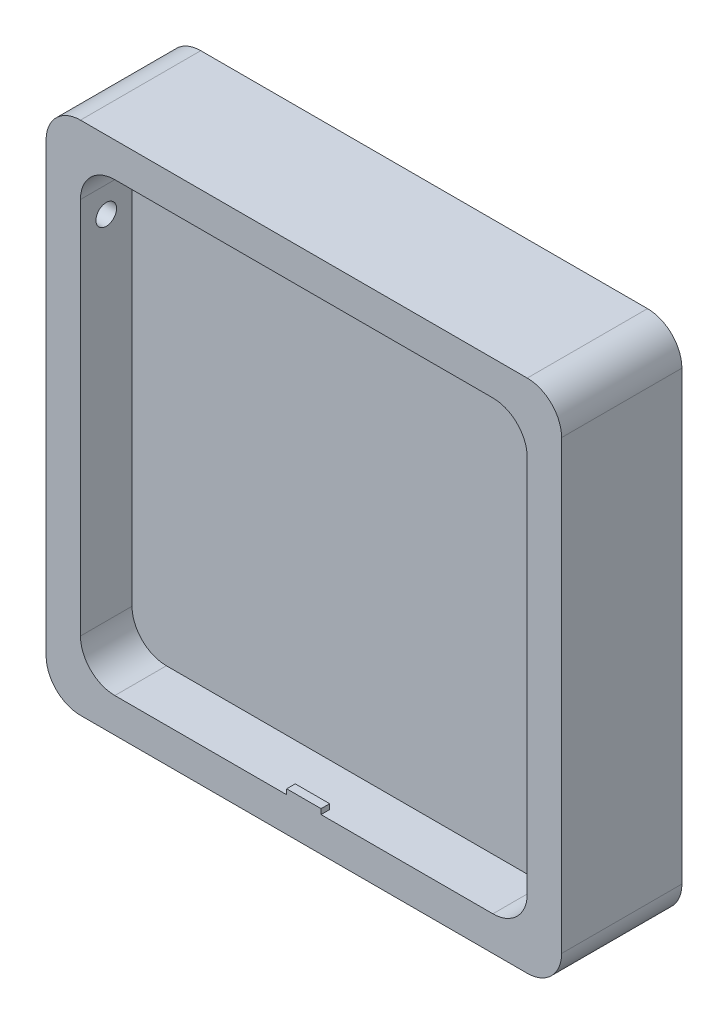
from build123d import *

# Parameters (mm, degrees)
EXTRUDE_1_DEPTH     = 5
EXTRUDE_START       = -2
EXTRUDE_3_DEPTH     = 2
EXTRUDE_4_DEPTH     = 1
SKETCH_9_R          = 13.798918301
SKETCH_9_R_2        = 9.326125992
CUT_EXTRUDE_2_DEPTH = 0.6
SKETCH_9_3_R        = 13.798918301
SKETCH_9_3_R_2      = 9.326125992
EXTRUDE_7_DEPTH     = 0.6
EXTRUDE_7_2_DEPTH   = 0.6
SKETCH_9_4_R        = 1.04307169
SKETCH_9_4_R_2      = 0.987090177
CUT_EXTRUDE_3_DEPTH = 23.338307904
EXTRUDE_8_DEPTH     = 0.6
EXTRUDE_8_2_DEPTH   = 0.6
EXTRUDE_8_3_DEPTH   = 0.6
EXTRUDE_8_4_DEPTH   = 0.6
EXTRUDE_8_5_DEPTH   = 0.6
EXTRUDE_8_6_DEPTH   = 0.6
EXTRUDE_8_7_DEPTH   = 0.6
EXTRUDE_8_8_DEPTH   = 0.6
SKETCH_9_5_R        = 1.04307169
EXTRUDE_8_9_DEPTH   = 0.6
SKETCH_9_5_R_2      = 0.987090177
EXTRUDE_8_10_DEPTH  = 0.6
SKETCH_10_R         = 0.987090177
SKETCH_10_R_2       = 1.04307169
EXTRUDE_9_DEPTH     = 0.6
EXTRUDE_11_DEPTH    = 0.4
SKETCH_12_R         = 0.6
CUT_EXTRUDE_4_DEPTH = 1.2
SKETCH_13_W         = 2
SKETCH_13_H         = 0.5
EXTRUDE_12_DEPTH    = 0.3


with BuildPart() as part:
    # 草图1 → 凸台-拉伸1 (new body)
    with BuildSketch(Plane.XY):
        with BuildLine():
            Line((13, 15), (-13, 15))
            ThreePointArc((-13, 15), (-14.414213562, 14.414213562), (-15, 13))
            Line((-15, 13), (-15, -13))
            ThreePointArc((-15, -13), (-14.414213562, -14.414213562), (-13, -15))
            Line((-13, -15), (13, -15))
            ThreePointArc((13, -15), (14.414213562, -14.414213562), (15, -13))
            Line((15, -13), (15, 13))
            ThreePointArc((15, 13), (14.414213562, 14.414213562), (13, 15))
        make_face()
        with BuildLine():
            ThreePointArc((-13, 11), (-12.414213562, 12.414213562), (-11, 13))
            Line((-11, 13), (11, 13))
            ThreePointArc((11, 13), (12.414213562, 12.414213562), (13, 11))
            Line((13, 11), (13, -11))
            ThreePointArc((13, -11), (12.414213562, -12.414213562), (11, -13))
            Line((11, -13), (-11, -13))
            ThreePointArc((-11, -13), (-12.414213562, -12.414213562), (-13, -11))
            Line((-13, -11), (-13, 11))
        make_face(mode=Mode.SUBTRACT)
    extrude(amount=EXTRUDE_1_DEPTH)

    # 草图1<7> → 凸台-拉伸3 (add)
    with BuildSketch(Plane.XY.offset(EXTRUDE_START)):
        with BuildLine():
            Line((-13, 15), (13, 15))
            ThreePointArc((13, 15), (14.414213562, 14.414213562), (15, 13))
            Line((15, 13), (15, -13))
            ThreePointArc((15, -13), (14.414213562, -14.414213562), (13, -15))
            Line((13, -15), (-13, -15))
            ThreePointArc((-13, -15), (-14.414213562, -14.414213562), (-15, -13))
            Line((-15, -13), (-15, 13))
            ThreePointArc((-15, 13), (-14.414213562, 14.414213562), (-13, 15))
        make_face()
    extrude(amount=EXTRUDE_3_DEPTH)

    # 草图3 → 凸台-拉伸4 (add)
    with BuildSketch(Plane.XY):
        with BuildLine():
            Line((-13, 11), (-13, -11))
            ThreePointArc((-13, -11), (-12.414213562, -12.414213562), (-11, -13))
            Line((-11, -13), (11, -13))
            ThreePointArc((11, -13), (12.414213562, -12.414213562), (13, -11))
            Line((13, -11), (13, 11))
            ThreePointArc((13, 11), (12.414213562, 12.414213562), (11, 13))
            Line((11, 13), (-11, 13))
            ThreePointArc((-11, 13), (-12.414213562, 12.414213562), (-13, 11))
        make_face()
    extrude(amount=EXTRUDE_4_DEPTH)

    # 草图9 → 切除-拉伸2 (cut)
    # profile 1 of 2: a face of its own
    with BuildSketch(Plane(origin=(0, 0, -2), x_dir=(-1, 0, 0), z_dir=(0, 0, -1))):
        Circle(SKETCH_9_R)
        with BuildLine():
            Line((-9.888054162, 2.28406073), (-12.681467364, 2.86316996))
            ThreePointArc((-12.681467364, 2.86316996), (-12.026515846, 4.937638437), (-11.034829358, 6.873856106))
            Line((-11.034829358, 6.873856106), (-8.690845875, 5.240204816))
            ThreePointArc((-8.690845875, 5.240204816), (-9.406305259, 3.809457956), (-9.888054162, 2.28406073))
        make_face(mode=Mode.SUBTRACT)
        with BuildLine():
            Line((-12.836530991, 2.059327278), (-10.028072657, 1.558302708))
            ThreePointArc((-10.028072657, 1.558302708), (-10.148356629, -0.037500321), (-10.016282444, -1.632370833))
            Line((-10.016282444, -1.632370833), (-12.816847155, -2.178482435))
            ThreePointArc((-12.816847155, -2.178482435), (-13.000527311, -0.060385025), (-12.836530991, 2.059327278))
        make_face(mode=Mode.SUBTRACT)
        with BuildLine():
            ThreePointArc((-5.987514309, 8.193913652), (-7.237123745, 7.114393047), (-8.295115314, 5.846504124))
            Line((-8.295115314, 5.846504124), (-10.626479159, 7.489679393))
            ThreePointArc((-10.626479159, 7.489679393), (-9.235940193, 9.149577338), (-7.589178852, 10.555648776))
            Line((-7.589178852, 10.555648776), (-5.987514309, 8.193913652))
        make_face(mode=Mode.SUBTRACT)
        with BuildLine():
            ThreePointArc((-2.416213789, 9.856594719), (-3.928425922, 9.357244162), (-5.343900786, 8.62747199))
            Line((-5.343900786, 8.62747199), (-6.941344254, 10.992501839))
            ThreePointArc((-6.941344254, 10.992501839), (-5.025776621, 11.989951046), (-2.971514644, 12.656518378))
            Line((-2.971514644, 12.656518378), (-2.416213789, 9.856594719))
        make_face(mode=Mode.SUBTRACT)
        with BuildLine():
            ThreePointArc((1.596521353, 10.022059075), (-0.038344555, 10.148353474), (-1.672209416, 10.009708498))
            Line((-1.672209416, 10.009708498), (-2.142188245, 12.82296324))
            ThreePointArc((-2.142188245, 12.82296324), (-0.017076876, 13.000656334), (2.108493972, 12.828546679))
            Line((2.108493972, 12.828546679), (1.596521353, 10.022059075))
        make_face(mode=Mode.SUBTRACT)
        with BuildLine():
            ThreePointArc((5.343900786, 8.62747199), (3.885665248, 9.375081553), (2.326115048, 9.87824566))
            Line((2.326115048, 9.87824566), (2.928030111, 12.666648981))
            ThreePointArc((2.928030111, 12.666648981), (4.987769571, 12.005811569), (6.909423009, 11.012594173))
            Line((6.909423009, 11.012594173), (5.343900786, 8.62747199))
        make_face(mode=Mode.SUBTRACT)
        with BuildLine():
            ThreePointArc((8.260078071, 5.895901865), (7.188306235, 7.16371426), (5.924174204, 8.239824545))
            Line((5.924174204, 8.239824545), (7.589178852, 10.555648776))
            ThreePointArc((7.589178852, 10.555648776), (9.208598496, 9.177094882), (10.581594608, 7.552960498))
            Line((10.581594608, 7.552960498), (8.260078071, 5.895901865))
        make_face(mode=Mode.SUBTRACT)
        with BuildLine():
            ThreePointArc((9.871964238, 2.352630574), (9.386242023, 3.858627895), (8.672317136, 5.270812463))
            Line((8.672317136, 5.270812463), (11.04594037, 6.855987024))
            ThreePointArc((11.04594037, 6.855987024), (12.005151381, 4.989358381), (12.651522641, 2.992713082))
            Line((12.651522641, 2.992713082), (9.871964238, 2.352630574))
        make_face(mode=Mode.SUBTRACT)
        with BuildLine():
            Line((10.029029819, 1.552130611), (12.847714869, 1.988360978))
            ThreePointArc((12.847714869, 1.988360978), (13.000310842, -0.096305483), (12.816847155, -2.178482435))
            Line((12.816847155, -2.178482435), (10.016282444, -1.632370833))
            ThreePointArc((10.016282444, -1.632370833), (10.148344608, -0.040623235), (10.029029819, 1.552130611))
        make_face(mode=Mode.SUBTRACT)
        with BuildLine():
            ThreePointArc((8.634150681, -5.333103276), (9.350135065, -3.945316565), (9.844729186, -2.464113591))
            Line((9.844729186, -2.464113591), (12.651522641, -2.992713082))
            ThreePointArc((12.651522641, -2.992713082), (11.983419277, -5.04133109), (10.986110749, -6.951455051))
            Line((10.986110749, -6.951455051), (8.634150681, -5.333103276))
        make_face(mode=Mode.SUBTRACT)
        with BuildLine():
            ThreePointArc((5.924174204, -8.239824545), (7.131904343, -7.219867657), (8.166588622, -6.024730601))
            Line((8.166588622, -6.024730601), (10.491279463, -7.677917162))
            ThreePointArc((10.491279463, -7.677917162), (9.12353904, -9.261662491), (7.519422651, -10.605453301))
            Line((7.519422651, -10.605453301), (5.924174204, -8.239824545))
        make_face(mode=Mode.SUBTRACT)
        with BuildLine():
            ThreePointArc((2.326115048, -9.87824566), (3.837148299, -9.395043452), (5.25441592, -8.682261334))
            Line((5.25441592, -8.682261334), (6.781441979, -11.091861945))
            ThreePointArc((6.781441979, -11.091861945), (4.88394496, -12.048420575), (2.855967553, -12.683091345))
            Line((2.855967553, -12.683091345), (2.326115048, -9.87824566))
        make_face(mode=Mode.SUBTRACT)
        with BuildLine():
            ThreePointArc((-1.598389743, -10.021761261), (-0.029492738, -10.148383059), (1.540113724, -10.030882227))
            Line((1.540113724, -10.030882227), (2.033639821, -12.8406256))
            ThreePointArc((2.033639821, -12.8406256), (-0.038615823, -13.000610199), (-2.109884502, -12.828318055))
            Line((-2.109884502, -12.828318055), (-1.598389743, -10.021761261))
        make_face(mode=Mode.SUBTRACT)
        with BuildLine():
            ThreePointArc((-5.219450379, -8.703326162), (-3.83734129, -9.394964628), (-2.366235371, -9.86871211))
            Line((-2.366235371, -9.86871211), (-2.971514644, -12.656518378))
            ThreePointArc((-2.971514644, -12.656518378), (-4.887394043, -12.047021881), (-6.686390553, -11.149418734))
            Line((-6.686390553, -11.149418734), (-5.219450379, -8.703326162))
        make_face(mode=Mode.SUBTRACT)
        with BuildLine():
            ThreePointArc((-8.166588622, -6.024730601), (-7.131904343, -7.219867657), (-5.924174204, -8.239824545))
            Line((-5.924174204, -8.239824545), (-7.589178852, -10.555648776))
            ThreePointArc((-7.589178852, -10.555648776), (-9.19766883, -9.188049021), (-10.563584642, -7.578128808))
            Line((-10.563584642, -7.578128808), (-8.166588622, -6.024730601))
        make_face(mode=Mode.SUBTRACT)
        with BuildLine():
            ThreePointArc((-9.844729186, -2.464113591), (-9.37115555, -3.895124157), (-8.690845875, -5.240204816))
            Line((-8.690845875, -5.240204816), (-11.006143529, -6.919693732))
            ThreePointArc((-11.006143529, -6.919693732), (-11.990687487, -5.024019339), (-12.651522641, -2.992713082))
            Line((-12.651522641, -2.992713082), (-9.844729186, -2.464113591))
        make_face(mode=Mode.SUBTRACT)
        Circle(SKETCH_9_R_2, mode=Mode.SUBTRACT)
    # profile 2 of 2: a face of its own
    with BuildSketch(Plane(origin=(0, 0, -2), x_dir=(-1, 0, 0), z_dir=(0, 0, -1))):
        Polygon((0.765466265, -2.743604247), (-0.773653968, -2.743604247), (-0.876061373, -2.933429076), (-0.876061373, -3.282192397), (-0.389543991, -3.718380394), (-0.426933858, -4.515354232), (-1.325188888, -5.333103276), (-1.325188888, -5.62273027), (-1.189470851, -5.771809513), (-0.909876296, -5.771809513), (-0.070976668, -5.008096151), (0.780857467, -5.771809513), (1.011276816, -5.865425536), (1.216941533, -5.678193491), (1.216941533, -5.333103276), (0.344773401, -4.375071694), (0.344773401, -3.718380394), (0.878335082, -3.123253904), align=None)
    extrude(amount=-CUT_EXTRUDE_2_DEPTH, mode=Mode.SUBTRACT)

    # 草图9<4> → 切除-拉伸3 (cut, through all)
    with BuildSketch(Plane(origin=(0, 0, -2), x_dir=(-1, 0, 0), z_dir=(0, 0, -1))):
        with BuildLine():
            ThreePointArc((-11.034829358, 6.873856106), (-12.026515846, 4.937638437), (-12.681467364, 2.86316996))
            Line((-12.681467364, 2.86316996), (-9.888054162, 2.28406073))
            ThreePointArc((-9.888054162, 2.28406073), (-9.406305259, 3.809457956), (-8.690845875, 5.240204816))
            Line((-8.690845875, 5.240204816), (-11.034829358, 6.873856106))
        make_face()
        with BuildLine():
            Line((-9.844729186, -2.464113591), (-12.651522641, -2.992713082))
            ThreePointArc((-12.651522641, -2.992713082), (-11.990687487, -5.024019339), (-11.006143529, -6.919693732))
            Line((-11.006143529, -6.919693732), (-8.690845875, -5.240204816))
            ThreePointArc((-8.690845875, -5.240204816), (-9.37115555, -3.895124157), (-9.844729186, -2.464113591))
        make_face()
        with BuildLine():
            ThreePointArc((-2.971514644, 12.656518378), (-5.025776621, 11.989951046), (-6.941344254, 10.992501839))
            Line((-6.941344254, 10.992501839), (-5.343900786, 8.62747199))
            ThreePointArc((-5.343900786, 8.62747199), (-3.928425922, 9.357244162), (-2.416213789, 9.856594719))
            Line((-2.416213789, 9.856594719), (-2.971514644, 12.656518378))
        make_face()
        with BuildLine():
            Line((-5.219450379, -8.703326162), (-6.686390553, -11.149418734))
            ThreePointArc((-6.686390553, -11.149418734), (-4.887394043, -12.047021881), (-2.971514644, -12.656518378))
            Line((-2.971514644, -12.656518378), (-2.366235371, -9.86871211))
            ThreePointArc((-2.366235371, -9.86871211), (-3.83734129, -9.394964628), (-5.219450379, -8.703326162))
        make_face()
        with BuildLine():
            ThreePointArc((6.909423009, 11.012594173), (4.987769571, 12.005811569), (2.928030111, 12.666648981))
            Line((2.928030111, 12.666648981), (2.326115048, 9.87824566))
            ThreePointArc((2.326115048, 9.87824566), (3.885665248, 9.375081553), (5.343900786, 8.62747199))
            Line((5.343900786, 8.62747199), (6.909423009, 11.012594173))
        make_face()
        with BuildLine():
            Line((2.326115048, -9.87824566), (2.855967553, -12.683091345))
            ThreePointArc((2.855967553, -12.683091345), (4.88394496, -12.048420575), (6.781441979, -11.091861945))
            Line((6.781441979, -11.091861945), (5.25441592, -8.682261334))
            ThreePointArc((5.25441592, -8.682261334), (3.837148299, -9.395043452), (2.326115048, -9.87824566))
        make_face()
        with BuildLine():
            ThreePointArc((12.651522641, 2.992713082), (12.005151381, 4.989358381), (11.04594037, 6.855987024))
            Line((11.04594037, 6.855987024), (8.672317136, 5.270812463))
            ThreePointArc((8.672317136, 5.270812463), (9.386242023, 3.858627895), (9.871964238, 2.352630574))
            Line((9.871964238, 2.352630574), (12.651522641, 2.992713082))
        make_face()
        with BuildLine():
            Line((8.634150681, -5.333103276), (10.986110749, -6.951455051))
            ThreePointArc((10.986110749, -6.951455051), (11.983419277, -5.04133109), (12.651522641, -2.992713082))
            Line((12.651522641, -2.992713082), (9.844729186, -2.464113591))
            ThreePointArc((9.844729186, -2.464113591), (9.350135065, -3.945316565), (8.634150681, -5.333103276))
        make_face()
        with Locations((-4.506399681, -2.865879477)):
            Circle(SKETCH_9_4_R)
        with Locations((4.354164914, -2.865879477)):
            Circle(SKETCH_9_4_R_2)
    extrude(amount=-CUT_EXTRUDE_3_DEPTH, mode=Mode.SUBTRACT)

    # 草图12 → 切除-拉伸4 (cut)
    with BuildSketch(Plane(origin=(-13, 0, 0), x_dir=(0, 0, -1), z_dir=(1, 0, 0))):
        with Locations((-3.5, 9.5)):
            Circle(SKETCH_12_R)
    cut_extrude_4 = extrude(amount=-CUT_EXTRUDE_4_DEPTH, mode=Mode.SUBTRACT)

    # 镜向1: 切除-拉伸4 across plane
    add(cut_extrude_4.mirror(Plane(origin=(0, 0, 0), x_dir=(0, 0, 1), z_dir=(1, 0, 0))), mode=Mode.SUBTRACT)

    # 草图13 → 凸台-拉伸12 (add)
    with BuildSketch(Plane(origin=(0, -13, 0), x_dir=(1, 0, 0), z_dir=(0, 1, 0))):
        with Locations((0, -4.75)):
            Rectangle(SKETCH_13_W, SKETCH_13_H)
    extrude(amount=EXTRUDE_12_DEPTH)


with BuildPart() as body_2:
    # 草图9<3> → 凸台-拉伸7 (new body)
    with BuildSketch(Plane(origin=(0, 0, -2), x_dir=(-1, 0, 0), z_dir=(0, 0, -1))):
        Circle(SKETCH_9_3_R)
        with BuildLine():
            Line((-9.888054162, 2.28406073), (-12.681467364, 2.86316996))
            ThreePointArc((-12.681467364, 2.86316996), (-12.026515846, 4.937638437), (-11.034829358, 6.873856106))
            Line((-11.034829358, 6.873856106), (-8.690845875, 5.240204816))
            ThreePointArc((-8.690845875, 5.240204816), (-9.406305259, 3.809457956), (-9.888054162, 2.28406073))
        make_face(mode=Mode.SUBTRACT)
        with BuildLine():
            Line((-12.836530991, 2.059327278), (-10.028072657, 1.558302708))
            ThreePointArc((-10.028072657, 1.558302708), (-10.148356629, -0.037500321), (-10.016282444, -1.632370833))
            Line((-10.016282444, -1.632370833), (-12.816847155, -2.178482435))
            ThreePointArc((-12.816847155, -2.178482435), (-13.000527311, -0.060385025), (-12.836530991, 2.059327278))
        make_face(mode=Mode.SUBTRACT)
        with BuildLine():
            ThreePointArc((-5.987514309, 8.193913652), (-7.237123745, 7.114393047), (-8.295115314, 5.846504124))
            Line((-8.295115314, 5.846504124), (-10.626479159, 7.489679393))
            ThreePointArc((-10.626479159, 7.489679393), (-9.235940193, 9.149577338), (-7.589178852, 10.555648776))
            Line((-7.589178852, 10.555648776), (-5.987514309, 8.193913652))
        make_face(mode=Mode.SUBTRACT)
        with BuildLine():
            ThreePointArc((-2.416213789, 9.856594719), (-3.928425922, 9.357244162), (-5.343900786, 8.62747199))
            Line((-5.343900786, 8.62747199), (-6.941344254, 10.992501839))
            ThreePointArc((-6.941344254, 10.992501839), (-5.025776621, 11.989951046), (-2.971514644, 12.656518378))
            Line((-2.971514644, 12.656518378), (-2.416213789, 9.856594719))
        make_face(mode=Mode.SUBTRACT)
        with BuildLine():
            ThreePointArc((1.596521353, 10.022059075), (-0.038344555, 10.148353474), (-1.672209416, 10.009708498))
            Line((-1.672209416, 10.009708498), (-2.142188245, 12.82296324))
            ThreePointArc((-2.142188245, 12.82296324), (-0.017076876, 13.000656334), (2.108493972, 12.828546679))
            Line((2.108493972, 12.828546679), (1.596521353, 10.022059075))
        make_face(mode=Mode.SUBTRACT)
        with BuildLine():
            ThreePointArc((5.343900786, 8.62747199), (3.885665248, 9.375081553), (2.326115048, 9.87824566))
            Line((2.326115048, 9.87824566), (2.928030111, 12.666648981))
            ThreePointArc((2.928030111, 12.666648981), (4.987769571, 12.005811569), (6.909423009, 11.012594173))
            Line((6.909423009, 11.012594173), (5.343900786, 8.62747199))
        make_face(mode=Mode.SUBTRACT)
        with BuildLine():
            ThreePointArc((8.260078071, 5.895901865), (7.188306235, 7.16371426), (5.924174204, 8.239824545))
            Line((5.924174204, 8.239824545), (7.589178852, 10.555648776))
            ThreePointArc((7.589178852, 10.555648776), (9.208598496, 9.177094882), (10.581594608, 7.552960498))
            Line((10.581594608, 7.552960498), (8.260078071, 5.895901865))
        make_face(mode=Mode.SUBTRACT)
        with BuildLine():
            ThreePointArc((9.871964238, 2.352630574), (9.386242023, 3.858627895), (8.672317136, 5.270812463))
            Line((8.672317136, 5.270812463), (11.04594037, 6.855987024))
            ThreePointArc((11.04594037, 6.855987024), (12.005151381, 4.989358381), (12.651522641, 2.992713082))
            Line((12.651522641, 2.992713082), (9.871964238, 2.352630574))
        make_face(mode=Mode.SUBTRACT)
        with BuildLine():
            Line((10.029029819, 1.552130611), (12.847714869, 1.988360978))
            ThreePointArc((12.847714869, 1.988360978), (13.000310842, -0.096305483), (12.816847155, -2.178482435))
            Line((12.816847155, -2.178482435), (10.016282444, -1.632370833))
            ThreePointArc((10.016282444, -1.632370833), (10.148344608, -0.040623235), (10.029029819, 1.552130611))
        make_face(mode=Mode.SUBTRACT)
        with BuildLine():
            ThreePointArc((8.634150681, -5.333103276), (9.350135065, -3.945316565), (9.844729186, -2.464113591))
            Line((9.844729186, -2.464113591), (12.651522641, -2.992713082))
            ThreePointArc((12.651522641, -2.992713082), (11.983419277, -5.04133109), (10.986110749, -6.951455051))
            Line((10.986110749, -6.951455051), (8.634150681, -5.333103276))
        make_face(mode=Mode.SUBTRACT)
        with BuildLine():
            ThreePointArc((5.924174204, -8.239824545), (7.131904343, -7.219867657), (8.166588622, -6.024730601))
            Line((8.166588622, -6.024730601), (10.491279463, -7.677917162))
            ThreePointArc((10.491279463, -7.677917162), (9.12353904, -9.261662491), (7.519422651, -10.605453301))
            Line((7.519422651, -10.605453301), (5.924174204, -8.239824545))
        make_face(mode=Mode.SUBTRACT)
        with BuildLine():
            ThreePointArc((2.326115048, -9.87824566), (3.837148299, -9.395043452), (5.25441592, -8.682261334))
            Line((5.25441592, -8.682261334), (6.781441979, -11.091861945))
            ThreePointArc((6.781441979, -11.091861945), (4.88394496, -12.048420575), (2.855967553, -12.683091345))
            Line((2.855967553, -12.683091345), (2.326115048, -9.87824566))
        make_face(mode=Mode.SUBTRACT)
        with BuildLine():
            ThreePointArc((-1.598389743, -10.021761261), (-0.029492738, -10.148383059), (1.540113724, -10.030882227))
            Line((1.540113724, -10.030882227), (2.033639821, -12.8406256))
            ThreePointArc((2.033639821, -12.8406256), (-0.038615823, -13.000610199), (-2.109884502, -12.828318055))
            Line((-2.109884502, -12.828318055), (-1.598389743, -10.021761261))
        make_face(mode=Mode.SUBTRACT)
        with BuildLine():
            ThreePointArc((-5.219450379, -8.703326162), (-3.83734129, -9.394964628), (-2.366235371, -9.86871211))
            Line((-2.366235371, -9.86871211), (-2.971514644, -12.656518378))
            ThreePointArc((-2.971514644, -12.656518378), (-4.887394043, -12.047021881), (-6.686390553, -11.149418734))
            Line((-6.686390553, -11.149418734), (-5.219450379, -8.703326162))
        make_face(mode=Mode.SUBTRACT)
        with BuildLine():
            ThreePointArc((-8.166588622, -6.024730601), (-7.131904343, -7.219867657), (-5.924174204, -8.239824545))
            Line((-5.924174204, -8.239824545), (-7.589178852, -10.555648776))
            ThreePointArc((-7.589178852, -10.555648776), (-9.19766883, -9.188049021), (-10.563584642, -7.578128808))
            Line((-10.563584642, -7.578128808), (-8.166588622, -6.024730601))
        make_face(mode=Mode.SUBTRACT)
        with BuildLine():
            ThreePointArc((-9.844729186, -2.464113591), (-9.37115555, -3.895124157), (-8.690845875, -5.240204816))
            Line((-8.690845875, -5.240204816), (-11.006143529, -6.919693732))
            ThreePointArc((-11.006143529, -6.919693732), (-11.990687487, -5.024019339), (-12.651522641, -2.992713082))
            Line((-12.651522641, -2.992713082), (-9.844729186, -2.464113591))
        make_face(mode=Mode.SUBTRACT)
        Circle(SKETCH_9_3_R_2, mode=Mode.SUBTRACT)
    extrude(amount=-EXTRUDE_7_DEPTH)


with BuildPart() as body_3:
    # 草图9<3> → Extrude 7 2 (new body)
    with BuildSketch(Plane(origin=(0, 0, -2), x_dir=(-1, 0, 0), z_dir=(0, 0, -1))):
        Polygon((0.765466265, -2.743604247), (-0.773653968, -2.743604247), (-0.876061373, -2.933429076), (-0.876061373, -3.282192397), (-0.389543991, -3.718380394), (-0.426933858, -4.515354232), (-1.325188888, -5.333103276), (-1.325188888, -5.62273027), (-1.189470851, -5.771809513), (-0.909876296, -5.771809513), (-0.070976668, -5.008096151), (0.780857467, -5.771809513), (1.011276816, -5.865425536), (1.216941533, -5.678193491), (1.216941533, -5.333103276), (0.344773401, -4.375071694), (0.344773401, -3.718380394), (0.878335082, -3.123253904), align=None)
    extrude(amount=-EXTRUDE_7_2_DEPTH)


with BuildPart() as body_4:
    # 草图9<5> → 凸台-拉伸8 (new body)
    with BuildSketch(Plane(origin=(0, 0, -2), x_dir=(-1, 0, 0), z_dir=(0, 0, -1))):
        with BuildLine():
            ThreePointArc((-11.034829358, 6.873856106), (-12.026515846, 4.937638437), (-12.681467364, 2.86316996))
            Line((-12.681467364, 2.86316996), (-9.888054162, 2.28406073))
            ThreePointArc((-9.888054162, 2.28406073), (-9.406305259, 3.809457956), (-8.690845875, 5.240204816))
            Line((-8.690845875, 5.240204816), (-11.034829358, 6.873856106))
        make_face()
    extrude(amount=-EXTRUDE_8_DEPTH)


with BuildPart() as body_5:
    # 草图9<5> → Extrude 8 2 (new body)
    with BuildSketch(Plane(origin=(0, 0, -2), x_dir=(-1, 0, 0), z_dir=(0, 0, -1))):
        with BuildLine():
            Line((-9.844729186, -2.464113591), (-12.651522641, -2.992713082))
            ThreePointArc((-12.651522641, -2.992713082), (-11.990687487, -5.024019339), (-11.006143529, -6.919693732))
            Line((-11.006143529, -6.919693732), (-8.690845875, -5.240204816))
            ThreePointArc((-8.690845875, -5.240204816), (-9.37115555, -3.895124157), (-9.844729186, -2.464113591))
        make_face()
    extrude(amount=-EXTRUDE_8_2_DEPTH)


with BuildPart() as body_6:
    # 草图9<5> → Extrude 8 3 (new body)
    with BuildSketch(Plane(origin=(0, 0, -2), x_dir=(-1, 0, 0), z_dir=(0, 0, -1))):
        with BuildLine():
            ThreePointArc((-2.971514644, 12.656518378), (-5.025776621, 11.989951046), (-6.941344254, 10.992501839))
            Line((-6.941344254, 10.992501839), (-5.343900786, 8.62747199))
            ThreePointArc((-5.343900786, 8.62747199), (-3.928425922, 9.357244162), (-2.416213789, 9.856594719))
            Line((-2.416213789, 9.856594719), (-2.971514644, 12.656518378))
        make_face()
    extrude(amount=-EXTRUDE_8_3_DEPTH)


with BuildPart() as body_7:
    # 草图9<5> → Extrude 8 4 (new body)
    with BuildSketch(Plane(origin=(0, 0, -2), x_dir=(-1, 0, 0), z_dir=(0, 0, -1))):
        with BuildLine():
            Line((-5.219450379, -8.703326162), (-6.686390553, -11.149418734))
            ThreePointArc((-6.686390553, -11.149418734), (-4.887394043, -12.047021881), (-2.971514644, -12.656518378))
            Line((-2.971514644, -12.656518378), (-2.366235371, -9.86871211))
            ThreePointArc((-2.366235371, -9.86871211), (-3.83734129, -9.394964628), (-5.219450379, -8.703326162))
        make_face()
    extrude(amount=-EXTRUDE_8_4_DEPTH)


with BuildPart() as body_8:
    # 草图9<5> → Extrude 8 5 (new body)
    with BuildSketch(Plane(origin=(0, 0, -2), x_dir=(-1, 0, 0), z_dir=(0, 0, -1))):
        with BuildLine():
            ThreePointArc((6.909423009, 11.012594173), (4.987769571, 12.005811569), (2.928030111, 12.666648981))
            Line((2.928030111, 12.666648981), (2.326115048, 9.87824566))
            ThreePointArc((2.326115048, 9.87824566), (3.885665248, 9.375081553), (5.343900786, 8.62747199))
            Line((5.343900786, 8.62747199), (6.909423009, 11.012594173))
        make_face()
    extrude(amount=-EXTRUDE_8_5_DEPTH)


with BuildPart() as body_9:
    # 草图9<5> → Extrude 8 6 (new body)
    with BuildSketch(Plane(origin=(0, 0, -2), x_dir=(-1, 0, 0), z_dir=(0, 0, -1))):
        with BuildLine():
            Line((2.326115048, -9.87824566), (2.855967553, -12.683091345))
            ThreePointArc((2.855967553, -12.683091345), (4.88394496, -12.048420575), (6.781441979, -11.091861945))
            Line((6.781441979, -11.091861945), (5.25441592, -8.682261334))
            ThreePointArc((5.25441592, -8.682261334), (3.837148299, -9.395043452), (2.326115048, -9.87824566))
        make_face()
    extrude(amount=-EXTRUDE_8_6_DEPTH)


with BuildPart() as body_10:
    # 草图9<5> → Extrude 8 7 (new body)
    with BuildSketch(Plane(origin=(0, 0, -2), x_dir=(-1, 0, 0), z_dir=(0, 0, -1))):
        with BuildLine():
            ThreePointArc((12.651522641, 2.992713082), (12.005151381, 4.989358381), (11.04594037, 6.855987024))
            Line((11.04594037, 6.855987024), (8.672317136, 5.270812463))
            ThreePointArc((8.672317136, 5.270812463), (9.386242023, 3.858627895), (9.871964238, 2.352630574))
            Line((9.871964238, 2.352630574), (12.651522641, 2.992713082))
        make_face()
    extrude(amount=-EXTRUDE_8_7_DEPTH)


with BuildPart() as body_11:
    # 草图9<5> → Extrude 8 8 (new body)
    with BuildSketch(Plane(origin=(0, 0, -2), x_dir=(-1, 0, 0), z_dir=(0, 0, -1))):
        with BuildLine():
            Line((8.634150681, -5.333103276), (10.986110749, -6.951455051))
            ThreePointArc((10.986110749, -6.951455051), (11.983419277, -5.04133109), (12.651522641, -2.992713082))
            Line((12.651522641, -2.992713082), (9.844729186, -2.464113591))
            ThreePointArc((9.844729186, -2.464113591), (9.350135065, -3.945316565), (8.634150681, -5.333103276))
        make_face()
    extrude(amount=-EXTRUDE_8_8_DEPTH)


with BuildPart() as body_12:
    # 草图9<5> → Extrude 8 9 (new body)
    with BuildSketch(Plane(origin=(0, 0, -2), x_dir=(-1, 0, 0), z_dir=(0, 0, -1))):
        with Locations((-4.506399681, -2.865879477)):
            Circle(SKETCH_9_5_R)
    extrude(amount=-EXTRUDE_8_9_DEPTH)


with BuildPart() as body_13:
    # 草图9<5> → Extrude 8 10 (new body)
    with BuildSketch(Plane(origin=(0, 0, -2), x_dir=(-1, 0, 0), z_dir=(0, 0, -1))):
        with Locations((4.354164914, -2.865879477)):
            Circle(SKETCH_9_5_R_2)
    extrude(amount=-EXTRUDE_8_10_DEPTH)


with BuildPart() as body_14:
    # 草图10 → 凸台-拉伸9 (new body)
    with BuildSketch(Plane.XY.offset(1)):
        with BuildLine():
            ThreePointArc((-11, 13), (-12.414213562, 12.414213562), (-13, 11))
            Line((-13, 11), (-13, -11))
            ThreePointArc((-13, -11), (-12.414213562, -12.414213562), (-11, -13))
            Line((-11, -13), (11, -13))
            ThreePointArc((11, -13), (12.414213562, -12.414213562), (13, -11))
            Line((13, -11), (13, 11))
            ThreePointArc((13, 11), (12.414213562, 12.414213562), (11, 13))
            Line((11, 13), (-11, 13))
        make_face()
        with BuildLine():
            Line((-2.326115048, -9.87824566), (-2.855967553, -12.683091345))
            ThreePointArc((-2.855967553, -12.683091345), (-4.88394496, -12.048420575), (-6.781441979, -11.091861945))
            Line((-6.781441979, -11.091861945), (-5.25441592, -8.682261334))
            ThreePointArc((-5.25441592, -8.682261334), (-3.837148299, -9.395043452), (-2.326115048, -9.87824566))
        make_face(mode=Mode.SUBTRACT)
        with BuildLine():
            ThreePointArc((-9.844729186, -2.464113591), (-9.350135065, -3.945316565), (-8.634150681, -5.333103276))
            Line((-8.634150681, -5.333103276), (-10.986110749, -6.951455051))
            ThreePointArc((-10.986110749, -6.951455051), (-11.983419277, -5.04133109), (-12.651522641, -2.992713082))
            Line((-12.651522641, -2.992713082), (-9.844729186, -2.464113591))
        make_face(mode=Mode.SUBTRACT)
        with Locations((-4.354164914, -2.865879477)):
            Circle(SKETCH_10_R, mode=Mode.SUBTRACT)
        with BuildLine():
            ThreePointArc((2.366235371, -9.86871211), (3.83734129, -9.394964628), (5.219450379, -8.703326162))
            Line((5.219450379, -8.703326162), (6.686390553, -11.149418734))
            ThreePointArc((6.686390553, -11.149418734), (4.887394043, -12.047021881), (2.971514644, -12.656518378))
            Line((2.971514644, -12.656518378), (2.366235371, -9.86871211))
        make_face(mode=Mode.SUBTRACT)
        with Locations((4.506399681, -2.865879477)):
            Circle(SKETCH_10_R_2, mode=Mode.SUBTRACT)
        with BuildLine():
            ThreePointArc((12.651522641, -2.992713082), (11.990687487, -5.024019339), (11.006143529, -6.919693732))
            Line((11.006143529, -6.919693732), (8.690845875, -5.240204816))
            ThreePointArc((8.690845875, -5.240204816), (9.37115555, -3.895124157), (9.844729186, -2.464113591))
            Line((9.844729186, -2.464113591), (12.651522641, -2.992713082))
        make_face(mode=Mode.SUBTRACT)
        with BuildLine():
            Line((-9.871964238, 2.352630574), (-12.651522641, 2.992713082))
            ThreePointArc((-12.651522641, 2.992713082), (-12.005151381, 4.989358381), (-11.04594037, 6.855987024))
            Line((-11.04594037, 6.855987024), (-8.672317136, 5.270812463))
            ThreePointArc((-8.672317136, 5.270812463), (-9.386242023, 3.858627895), (-9.871964238, 2.352630574))
        make_face(mode=Mode.SUBTRACT)
        with BuildLine():
            ThreePointArc((-2.326115048, 9.87824566), (-3.885665248, 9.375081553), (-5.343900786, 8.62747199))
            Line((-5.343900786, 8.62747199), (-6.909423009, 11.012594173))
            ThreePointArc((-6.909423009, 11.012594173), (-4.987769571, 12.005811569), (-2.928030111, 12.666648981))
            Line((-2.928030111, 12.666648981), (-2.326115048, 9.87824566))
        make_face(mode=Mode.SUBTRACT)
        with BuildLine():
            Line((12.681467364, 2.86316996), (9.888054162, 2.28406073))
            ThreePointArc((9.888054162, 2.28406073), (9.406305259, 3.809457956), (8.690845875, 5.240204816))
            Line((8.690845875, 5.240204816), (11.034829358, 6.873856106))
            ThreePointArc((11.034829358, 6.873856106), (12.026515846, 4.937638437), (12.681467364, 2.86316996))
        make_face(mode=Mode.SUBTRACT)
        with BuildLine():
            ThreePointArc((2.971514644, 12.656518378), (5.025776621, 11.989951046), (6.941344254, 10.992501839))
            Line((6.941344254, 10.992501839), (5.343900786, 8.62747199))
            ThreePointArc((5.343900786, 8.62747199), (3.928425922, 9.357244162), (2.416213789, 9.856594719))
            Line((2.416213789, 9.856594719), (2.971514644, 12.656518378))
        make_face(mode=Mode.SUBTRACT)
    extrude(amount=EXTRUDE_9_DEPTH)


with BuildPart() as body_15:
    # 草图11 → 凸台-拉伸11 (new body)
    with BuildSketch(Plane.XY.offset(1.6)):
        with BuildLine():
            Line((11, 13), (-11, 13))
            ThreePointArc((-11, 13), (-12.414213562, 12.414213562), (-13, 11))
            Line((-13, 11), (-13, -11))
            ThreePointArc((-13, -11), (-12.414213562, -12.414213562), (-11, -13))
            Line((-11, -13), (11, -13))
            ThreePointArc((11, -13), (12.414213562, -12.414213562), (13, -11))
            Line((13, -11), (13, 11))
            ThreePointArc((13, 11), (12.414213562, 12.414213562), (11, 13))
        make_face()
    extrude(amount=EXTRUDE_11_DEPTH)


solid = Compound([part.part, body_2.part, body_3.part, body_4.part, body_5.part, body_6.part, body_7.part, body_8.part, body_9.part, body_10.part, body_11.part, body_12.part, body_13.part, body_14.part, body_15.part])
